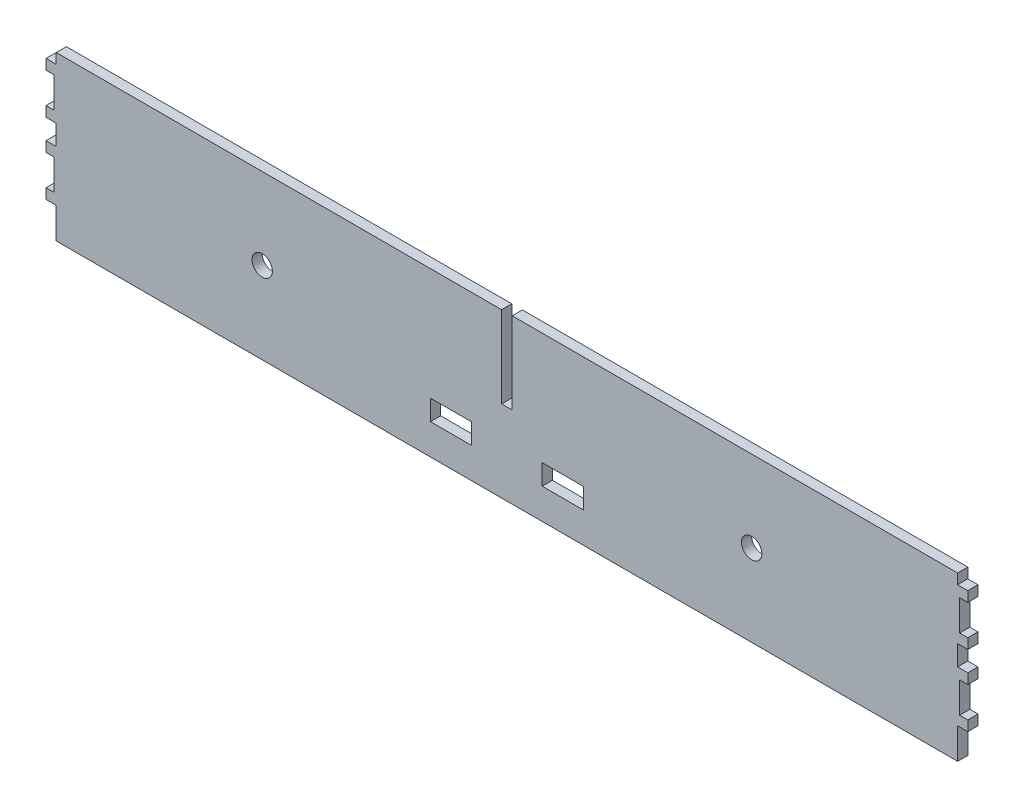
from build123d import *

# Parameters (mm, degrees)
SKETCH1_W               = 442
SKETCH1_H               = 80
BOSS_EXTRUDE1_DEPTH     = 2.5
CUT_EXTRUDE3_DEPTH      = 236.047335658
CUT_EXTRUDE3_DEPTH_BACK = 236.047335658
SKETCH4_W               = 5.2
SKETCH4_H               = 40
SKETCH6_W               = 5
SKETCH6_H               = 25
BOSS_EXTRUDE2_DEPTH     = 5
SKETCH7_W               = 5
SKETCH7_H               = 15
CUT_EXTRUDE5_DEPTH      = 4
SKETCH9_W               = 20.2
SKETCH9_H               = 10
CUT_EXTRUDE7_DEPTH      = 300
SKETCH10_R              = 5
CUT_EXTRUDE8_DEPTH      = 10


with BuildPart() as part:
    # Sketch1 → Boss-Extrude1 (new, symmetric)
    with BuildSketch(Plane.XY):
        with Locations((0, 40)):
            Rectangle(SKETCH1_W, SKETCH1_H)
    extrude(amount=BOSS_EXTRUDE1_DEPTH, both=True)

    # Sketch4 → Cut-Extrude3 (cut, two sides: drawn at the far end of the back side and taken through both)
    with BuildSketch(Plane.XY.offset(-CUT_EXTRUDE3_DEPTH_BACK)):
        with Locations((0, 60)):
            Rectangle(SKETCH4_W, SKETCH4_H)
    extrude(amount=CUT_EXTRUDE3_DEPTH + CUT_EXTRUDE3_DEPTH_BACK, mode=Mode.SUBTRACT)

    # Sketch6 → Boss-Extrude2 (add)
    with BuildSketch(Plane.ZY.offset(221)):
        with Locations((0, 62.5)):
            Rectangle(SKETCH6_W, SKETCH6_H)
        with Locations((0, 27.6)):
            Rectangle(SKETCH6_W, SKETCH6_H)
    boss_extrude2 = extrude(amount=BOSS_EXTRUDE2_DEPTH)

    # Sketch7 → Cut-Extrude5 (cut)
    with BuildSketch(Plane.ZY.offset(226)):
        with Locations((0, 62.5)):
            Rectangle(SKETCH7_W, SKETCH7_H)
        with Locations((0, 27.6)):
            Rectangle(SKETCH7_W, SKETCH7_H)
    cut_extrude5 = extrude(amount=-CUT_EXTRUDE5_DEPTH, mode=Mode.SUBTRACT)

    # Mirror8: Boss-Extrude2, Cut-Extrude5 across plane
    add(boss_extrude2.mirror(Plane(origin=(0, 0, 0), x_dir=(0, 0, 1), z_dir=(1, 0, 0))))
    add(cut_extrude5.mirror(Plane(origin=(0, 0, 0), x_dir=(0, 0, 1), z_dir=(1, 0, 0))), mode=Mode.SUBTRACT)

    # Sketch9 → Cut-Extrude7 (cut)
    with BuildSketch(Plane(origin=(102.718818309, -565.456150304, 2.5), x_dir=(1, 0, 0), z_dir=(0, 0, 1))):
        with Locations((-130.118818309, 585.456150304)):
            Rectangle(SKETCH9_W, SKETCH9_H)
    cut_extrude7 = extrude(amount=-CUT_EXTRUDE7_DEPTH, mode=Mode.SUBTRACT)

    # Mirror9: Cut-Extrude7 across plane
    add(cut_extrude7.mirror(Plane(origin=(0, 0, 0), x_dir=(0, 0, 1), z_dir=(1, 0, 0))), mode=Mode.SUBTRACT)

    # Sketch10 → Cut-Extrude8 (cut)
    with BuildSketch(Plane.XY.offset(2.5)):
        with Locations((-120, 40.1)):
            Circle(SKETCH10_R)
        with Locations((120, 40.1)):
            Circle(SKETCH10_R)
    extrude(amount=-CUT_EXTRUDE8_DEPTH, mode=Mode.SUBTRACT)


solid = part.part
